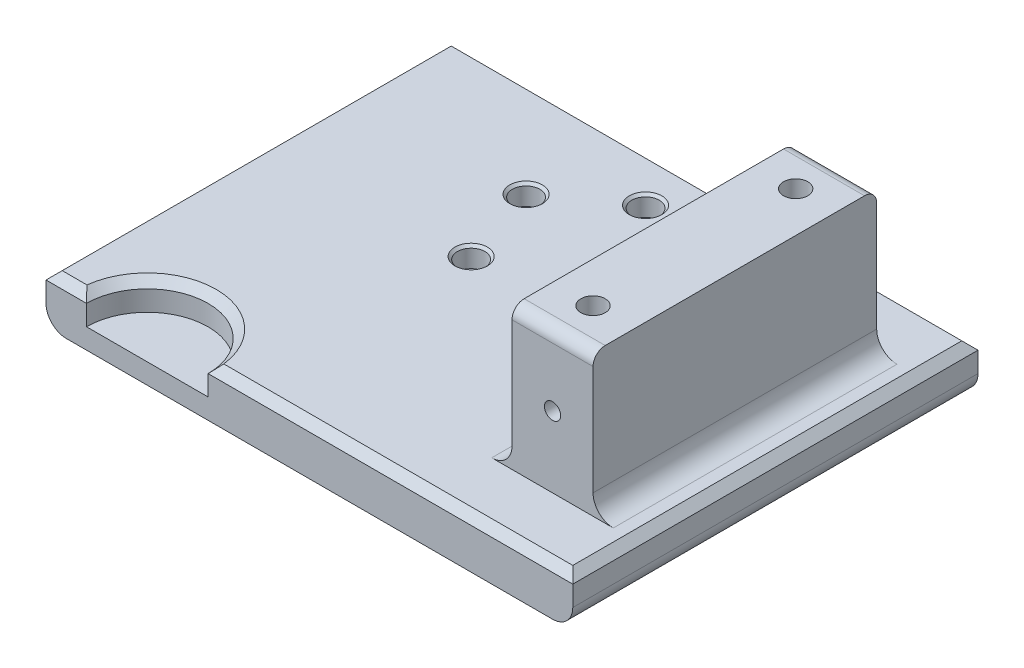
from build123d import *

# Parameters (mm, degrees)
SKETCH1_W                   = 130
SKETCH1_H                   = 100
BOSS_EXTRUDE1_DEPTH         = 12
CUT_EXTRUDE1_DEPTH          = 7
SKETCH4_W                   = 20
SKETCH4_H                   = 70
BOSS_EXTRUDE2_DEPTH         = 35
SKETCH5_W                   = 25
SKETCH5_H                   = 8
SKETCH5_W_2                 = 20
SKETCH5_H_2                 = 2
FILLET1_R                   = 5
CHAMFER1_SIZE               = 2
M8_TAPPED_HOLE1_D           = 6.8
M8_TAPPED_HOLE1_DEPTH       = 5
M8_TAPPED_HOLE1_CSINK_D     = 8.05
M8_TAPPED_HOLE1_CSINK_ANGLE = 90
M8_TAPPED_HOLE1_TIP         = 2.042926105
CUT_EXTRUDE2_REACH          = 172.614
SKETCH13_R                  = 3
FILLET2_R                   = 3
FILLET3_R                   = 5


with BuildPart() as part:
    # Sketch1 → Boss-Extrude1 (new body)
    with BuildSketch(Plane(origin=(0, 0, 0), x_dir=(1, 0, 0), z_dir=(0, 1, 0))):
        with Locations((65, 50)):
            Rectangle(SKETCH1_W, SKETCH1_H)
    extrude(amount=BOSS_EXTRUDE1_DEPTH)

    # Sketch3 → Cut-Extrude1 (cut)
    with BuildSketch(Plane(origin=(0, 12, 0), x_dir=(1, 0, 0), z_dir=(0, 1, 0))):
        with BuildLine():
            Line((10, 0), (40, 0))
            ThreePointArc((40, 0), (25, 15), (10, 0))
        make_face()
    extrude(amount=-CUT_EXTRUDE1_DEPTH, mode=Mode.SUBTRACT)

    # Sketch4 → Boss-Extrude2 (add)
    with BuildSketch(Plane(origin=(0, 12, 0), x_dir=(1, 0, 0), z_dir=(0, 1, 0))):
        with Locations((110, 50)):
            Rectangle(SKETCH4_W, SKETCH4_H)
    extrude(amount=BOSS_EXTRUDE2_DEPTH)

    # Sketch5 → Cut-Revolve1 (revolve, cut)
    with BuildSketch(Plane.ZY.offset(-110), mode=Mode.PRIVATE) as cut_revolve1_sk:
        with Locations((-72.5, 33.5)):
            Rectangle(SKETCH5_W, SKETCH5_H)
        Polygon((-60, 33.5), (-60, 29.5), (-35, 29.5), (-35, 31.5), (-35, 33.5), align=None)
        with Locations((-25, 30.5)):
            Rectangle(SKETCH5_W_2, SKETCH5_H_2)
    revolve(cut_revolve1_sk.sketch.rotate(Axis((110, 29.5, -85), (0, 0, 1)), 90), axis=Axis((110, 29.5, -85), (0, 0, 1)), mode=Mode.SUBTRACT)

    # Fillet1
    fillet1_edges = [part.edges().sort_by_distance(p)[0] for p in [
        (100, 12, -50),
        (120, 12, -50),
    ]]
    fillet(fillet1_edges, radius=FILLET1_R)

    # Chamfer1
    chamfer1_edges = [part.edges().sort_by_distance(p)[0] for p in [
        (130, 12, -50),
        (85, 12, 0),
        (65, 12, -100),
        (25, 12, -15),
        (0, 12, -50),
        (5, 12, 0),
    ]]
    chamfer(chamfer1_edges, length=CHAMFER1_SIZE)

    # M8 Tapped Hole1
    with Locations(Plane(origin=(0, 12, 0), x_dir=(1, 0, 0), z_dir=(0, 1, 0))):
        with Locations((42.923730365, 75.548416342), (60, 87.955052452), (77.076269635, 75.548416342), (70.553715035, 55.474057432), (49.446284965, 55.474057432)):
            CounterSinkHole(M8_TAPPED_HOLE1_D / 2, M8_TAPPED_HOLE1_CSINK_D / 2, depth=M8_TAPPED_HOLE1_DEPTH, counter_sink_angle=M8_TAPPED_HOLE1_CSINK_ANGLE)
            with Locations((0, 0, -(M8_TAPPED_HOLE1_DEPTH + M8_TAPPED_HOLE1_TIP / 2))):  # 118° drill point
                Cone(0, M8_TAPPED_HOLE1_D / 2, M8_TAPPED_HOLE1_TIP, mode=Mode.SUBTRACT)

    # Cut-Extrude2: up to this face of the body (flat: up to its plane)
    cut_extrude2_end = Plane(part.part.faces().sort_by_distance((56.685777118, 12, -51.176723205))[0])
    # Sketch13 → Cut-Extrude2 (cut, up to the picked face)
    with BuildSketch(Plane(origin=(0, 47, 0), x_dir=(1, 0, 0), z_dir=(0, 1, 0)), mode=Mode.PRIVATE) as cut_extrude2_sk1:
        with Locations(Location((110, 75, 0), (0, 0, 270))):
            Circle(SKETCH13_R)
    cut_extrude2_tool1 = split(extrude(cut_extrude2_sk1.sketch, amount=-CUT_EXTRUDE2_REACH, mode=Mode.PRIVATE), bisect_by=cut_extrude2_end, keep=Keep.BOTH, mode=Mode.PRIVATE)
    # Sketch13 → Cut-Extrude2 (cut, up to the picked face)
    with BuildSketch(Plane(origin=(0, 47, 0), x_dir=(1, 0, 0), z_dir=(0, 1, 0)), mode=Mode.PRIVATE) as cut_extrude2_sk2:
        with Locations(Location((110, 25, 0), (0, 0, 270))):
            Circle(SKETCH13_R)
    cut_extrude2_tool2 = split(extrude(cut_extrude2_sk2.sketch, amount=-CUT_EXTRUDE2_REACH, mode=Mode.PRIVATE), bisect_by=cut_extrude2_end, keep=Keep.BOTH, mode=Mode.PRIVATE)
    add(cut_extrude2_tool1.solids().sort_by(Axis((110, 47, -75), (0, -1, 0)))[0], mode=Mode.SUBTRACT)
    add(cut_extrude2_tool2.solids().sort_by(Axis((110, 47, -25), (0, -1, 0)))[0], mode=Mode.SUBTRACT)

    # Fillet2
    fillet2_edges = [part.edges().sort_by_distance(p)[0] for p in [
        (110, 47, -15),
        (110, 47, -85),
    ]]
    fillet(fillet2_edges, radius=FILLET2_R)

    # Fillet3
    fillet3_edges = [part.edges().sort_by_distance(p)[0] for p in [
        (130, 0, -50),
        (0, 0, -50),
    ]]
    fillet(fillet3_edges, radius=FILLET3_R)


solid = part.part
